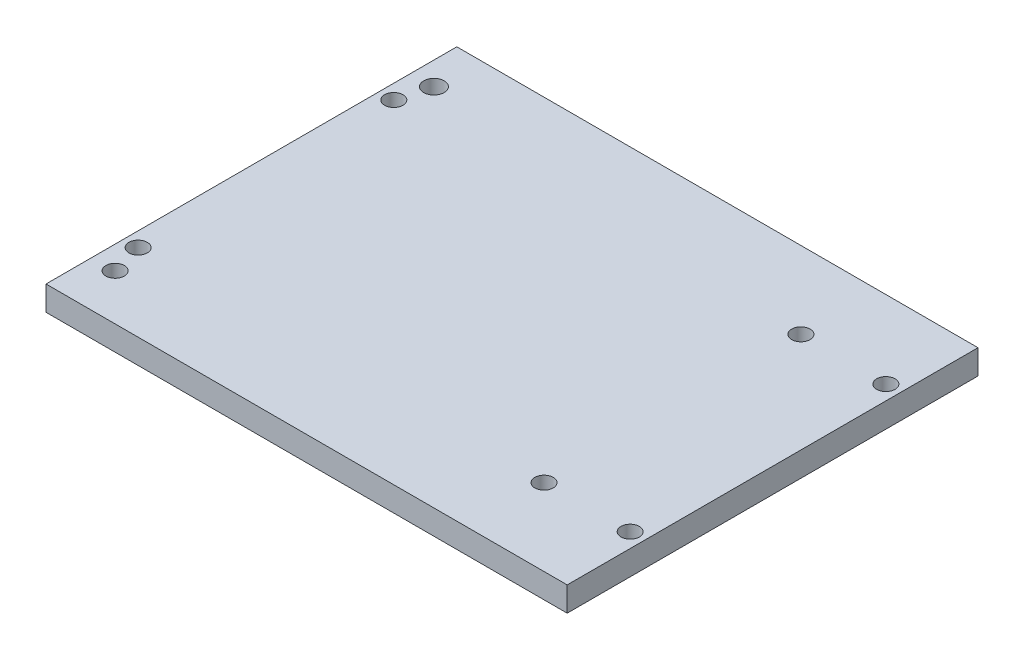
from build123d import *

# Parameters (mm, degrees)
SKETCH1_W           = 85
SKETCH1_H           = 67
BOSS_EXTRUDE1_DEPTH = 4
SKETCH2_R           = 1.5
CUT_EXTRUDE1_DEPTH  = 4
SKETCH3_R           = 1.5
SKETCH3_R_2         = 1.67
CUT_EXTRUDE2_DEPTH  = 10


with BuildPart() as part:
    # Sketch1 → Boss-Extrude1 (new body)
    with BuildSketch(Plane(origin=(0, 0, 0), x_dir=(1, 0, 0), z_dir=(0, 1, 0))):
        Rectangle(SKETCH1_W, SKETCH1_H)
    extrude(amount=BOSS_EXTRUDE1_DEPTH)

    # Sketch2 → Cut-Extrude1 (cut)
    with BuildSketch(Plane(origin=(0, 4, 0), x_dir=(1, 0, 0), z_dir=(0, 1, 0))):
        with Locations(Location((-40.125, 20.85, 0), (0, 0, 270))):
            Circle(SKETCH2_R)
        with Locations(Location((-40.125, -20.85, 0), (0, 0, 270))):
            Circle(SKETCH2_R)
        with Locations(Location((40.125, 20.85, 0), (0, 0, 270))):
            Circle(SKETCH2_R)
        with Locations(Location((40.125, -20.85, 0), (0, 0, 270))):
            Circle(SKETCH2_R)
    extrude(amount=-CUT_EXTRUDE1_DEPTH, mode=Mode.SUBTRACT)

    # Sketch3 → Cut-Extrude2 (cut)
    with BuildSketch(Plane(origin=(0, 4, 0), x_dir=(1, 0, 0), z_dir=(0, 1, 0))):
        with Locations(Location((26.173152267, 20.95, 0), (0, 0, 270))):
            Circle(SKETCH3_R)
        with Locations(Location((26.173152267, -20.95, 0), (0, 0, 270))):
            Circle(SKETCH3_R)
        with Locations(Location((-38.73, 26, 0), (0, 0, 270))):
            Circle(SKETCH3_R_2)
        with Locations(Location((-38.73, -26, 0), (0, 0, 270))):
            Circle(SKETCH3_R)
    extrude(amount=-CUT_EXTRUDE2_DEPTH, mode=Mode.SUBTRACT)


solid = part.part
